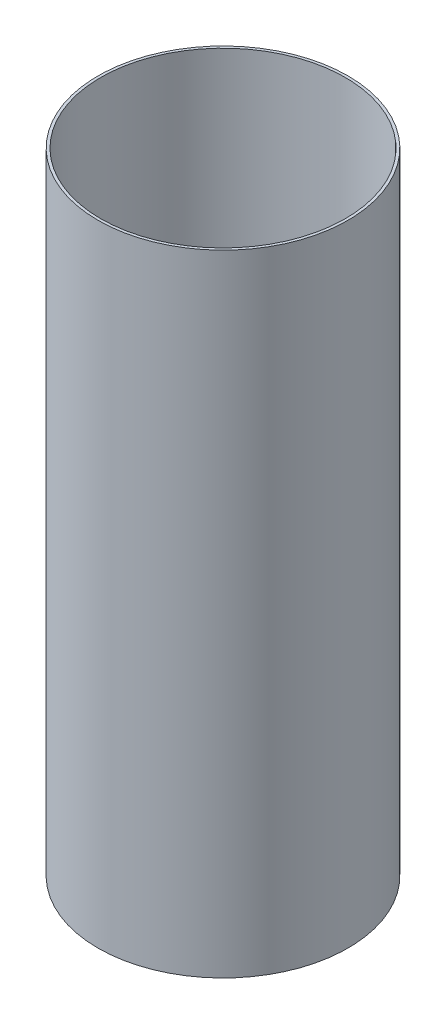
from build123d import *

# Parameters (mm, degrees)
SKETCH1_R           = 78.105
SKETCH1_R_2         = 76.4286
BOSS_EXTRUDE1_DEPTH = 393.7


with BuildPart() as part:
    # Sketch1 → Boss-Extrude1 (new body)
    with BuildSketch(Plane(origin=(0, 0, 0), x_dir=(1, 0, 0), z_dir=(0, 1, 0))):
        with Locations(Location((0, 0, 0), (0, 0, 270))):
            Circle(SKETCH1_R)
        with Locations(Location((0, 0, 0), (0, 0, 270))):
            Circle(SKETCH1_R_2, mode=Mode.SUBTRACT)
    extrude(amount=BOSS_EXTRUDE1_DEPTH)


solid = part.part
